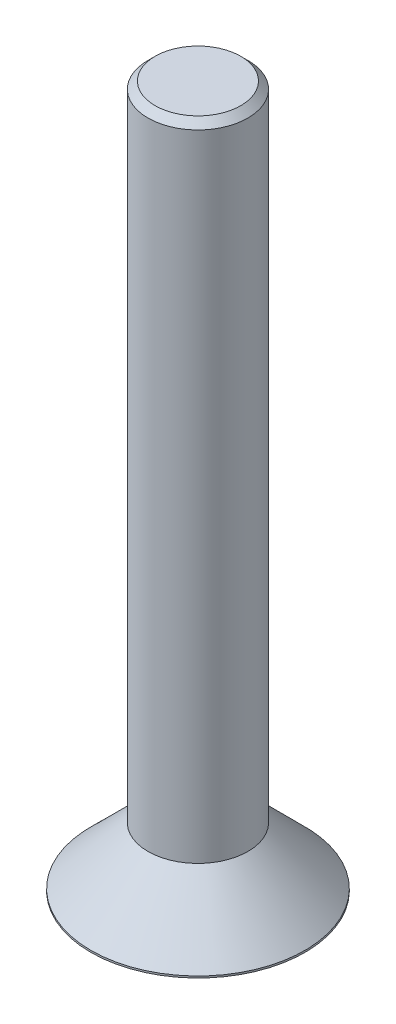
from build123d import *

# Parameters (mm, degrees)
SKETCH_1_R          = 3
EXTRUDE_1_DEPTH     = 1.65
CHAMFER_1_SIZE      = 1.6
CUT_EXTRUDE_1_DEPTH = 0.95
SKETCH_3_R          = 1.4
EXTRUDE_2_DEPTH     = 18
CHAMFER_2_SIZE      = 0.2


with BuildPart() as part:
    # 草图1 → 凸台-拉伸1 (new body)
    with BuildSketch(Plane(origin=(0, 0, 0), x_dir=(1, 0, 0), z_dir=(0, 1, 0))):
        with Locations(Location((0, 0, 0), (0, 0, 270))):
            Circle(SKETCH_1_R)
    extrude(amount=EXTRUDE_1_DEPTH)

    # 倒角1
    chamfer_1_edges = [part.edges().sort_by_distance(p)[0] for p in [
        (0, 1.65, -3),
    ]]
    chamfer(chamfer_1_edges, length=CHAMFER_1_SIZE)

    # 草图2 → 切除-拉伸1 (cut)
    with BuildSketch(Plane.XZ):
        Polygon((1, -0.577350269), (1, 0.577350269), (0, 1.154700538), (-1, 0.577350269), (-1, -0.577350269), (0, -1.154700538), align=None)
    extrude(amount=-CUT_EXTRUDE_1_DEPTH, mode=Mode.SUBTRACT)

    # 草图3 → 凸台-拉伸2 (add)
    with BuildSketch(Plane(origin=(0, 1.65, 0), x_dir=(1, 0, 0), z_dir=(0, 1, 0))):
        with Locations(Location((0, 0, 0), (0, 0, 270))):
            Circle(SKETCH_3_R)
    extrude(amount=EXTRUDE_2_DEPTH)

    # 倒角2
    chamfer_2_edges = [part.edges().sort_by_distance(p)[0] for p in [
        (0, 19.65, -1.4),
    ]]
    chamfer(chamfer_2_edges, length=CHAMFER_2_SIZE)


solid = part.part
